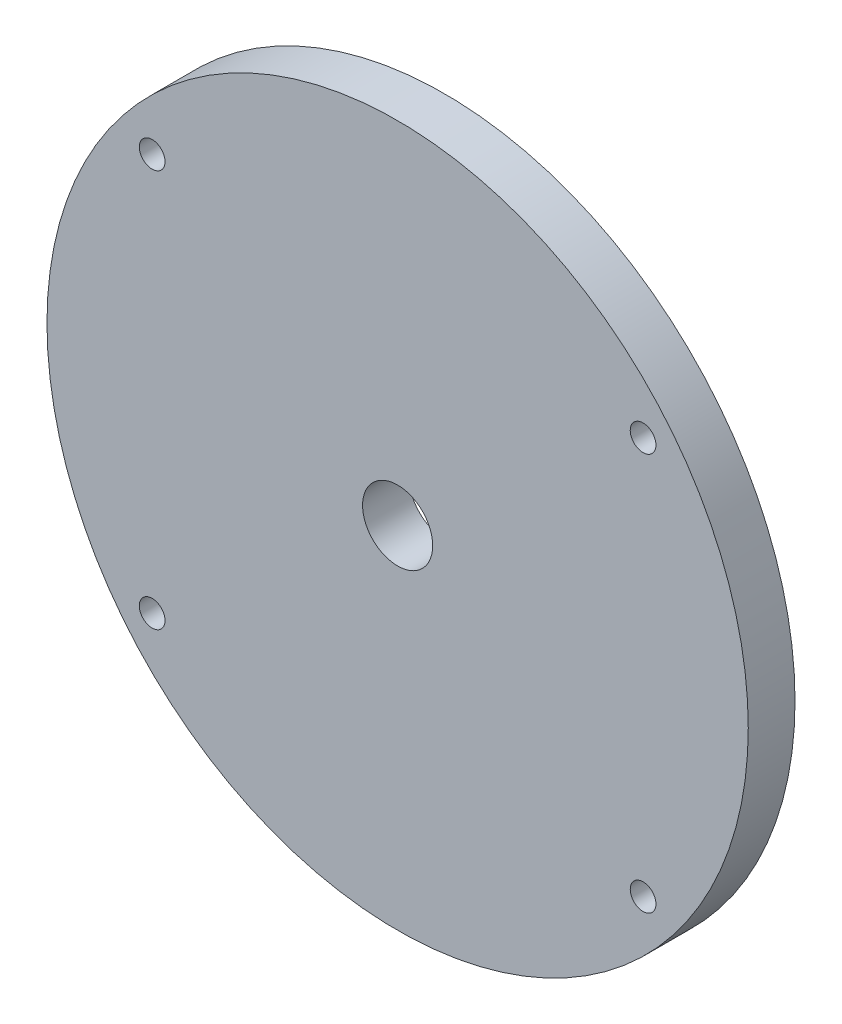
from build123d import *

# Parameters (mm, degrees)
SKETCH1_R                                       = 75
SKETCH1_R_2                                     = 7.5
BOSS_EXTRUDE1_DEPTH                             = 10
SKETCH2_R                                       = 1.5
CUT_EXTRUDE1_DEPTH                              = 107.536378763
CSK_FOR_M5_FLAT_HEAD_MACHINE_SCREW1_D           = 5.5
CSK_FOR_M5_FLAT_HEAD_MACHINE_SCREW1_CSINK_D     = 10.4
CSK_FOR_M5_FLAT_HEAD_MACHINE_SCREW1_CSINK_ANGLE = 90


with BuildPart() as part:
    # Sketch1 → Boss-Extrude1 (new body)
    with BuildSketch(Plane(origin=(0, 0, 0), x_dir=(0, 1, 0), z_dir=(0, 0, 1))):
        with Locations(Location((0, 0, 0), (0, 0, 270))):
            Circle(SKETCH1_R)
        with Locations(Location((0, 0, 0), (0, 0, 270))):
            Circle(SKETCH1_R_2, mode=Mode.SUBTRACT)
    extrude(amount=BOSS_EXTRUDE1_DEPTH)

    # Sketch2 → Cut-Extrude1 (cut, through all)
    with BuildSketch(Plane.XY.offset(10)):
        with Locations((-52.5, 42.5)):
            Circle(SKETCH2_R)
        with Locations((52.5, 42.5)):
            Circle(SKETCH2_R)
        with Locations((52.5, -42.5)):
            Circle(SKETCH2_R)
        with Locations((-52.5, -42.5)):
            Circle(SKETCH2_R)
    extrude(amount=-CUT_EXTRUDE1_DEPTH, mode=Mode.SUBTRACT)

    # CSK for M5 Flat Head Machine Screw1 (through all)
    with Locations(Plane(origin=(-52.5, -42.5, 0), x_dir=(-1, 0, 0), z_dir=(0, 0, -1))):
        with Locations((0, 0), (-105, 0), (-105, 85), (0, 85)):
            CounterSinkHole(CSK_FOR_M5_FLAT_HEAD_MACHINE_SCREW1_D / 2, CSK_FOR_M5_FLAT_HEAD_MACHINE_SCREW1_CSINK_D / 2, counter_sink_angle=CSK_FOR_M5_FLAT_HEAD_MACHINE_SCREW1_CSINK_ANGLE)


solid = part.part
